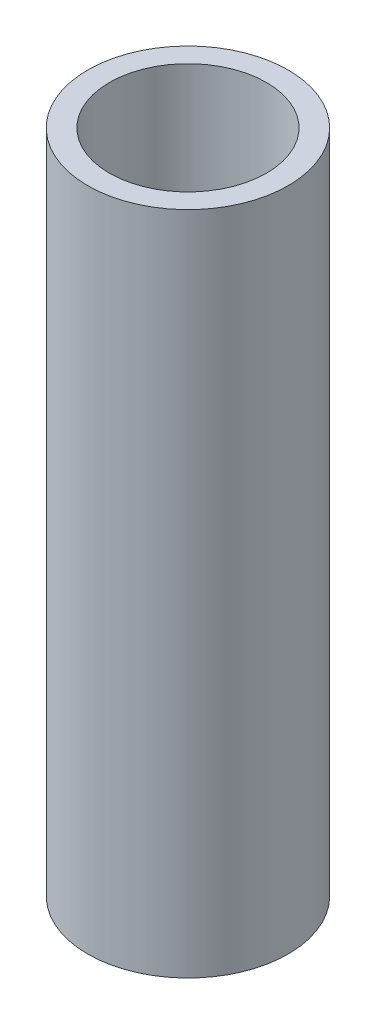
from build123d import *

# Parameters (mm, degrees)
SKETCH1_R           = 6.25
BOSS_EXTRUDE1_DEPTH = 41.5
SKETCH2_R           = 4.9
CUT_EXTRUDE1_DEPTH  = 43.430826058


with BuildPart() as part:
    # Sketch1 → Boss-Extrude1 (new body)
    with BuildSketch(Plane(origin=(0, 0, 0), x_dir=(1, 0, 0), z_dir=(0, 1, 0))):
        with Locations(Location((0, 0, 0), (0, 0, 270))):
            Circle(SKETCH1_R)
    extrude(amount=BOSS_EXTRUDE1_DEPTH)

    # Sketch2 → Cut-Extrude1 (cut, through all)
    with BuildSketch(Plane(origin=(0, 41.5, 0), x_dir=(1, 0, 0), z_dir=(0, 1, 0))):
        with Locations(Location((0, 0, 0), (0, 0, 270))):
            Circle(SKETCH2_R)
    extrude(amount=-CUT_EXTRUDE1_DEPTH, mode=Mode.SUBTRACT)


solid = part.part
